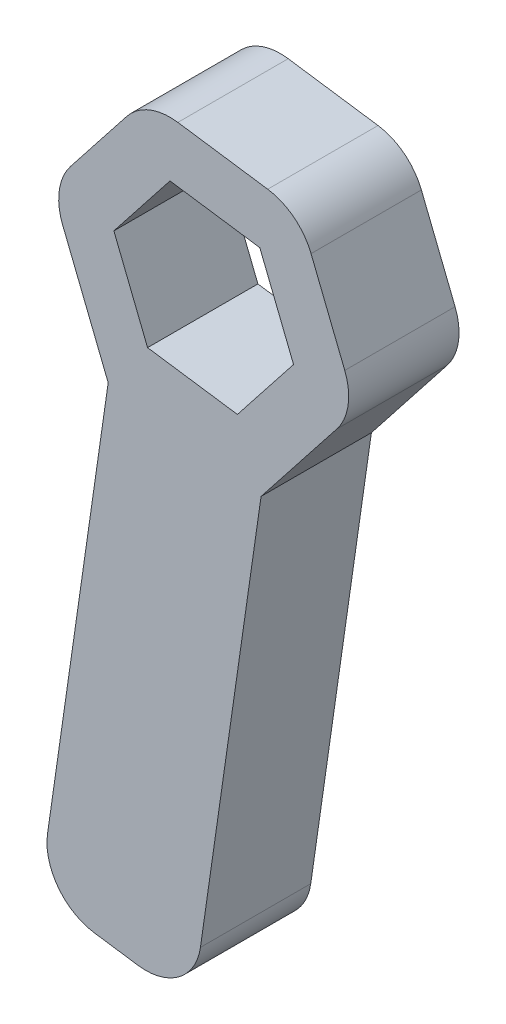
from build123d import *

# Parameters (mm, degrees)
BOSS_EXTRUDE1_DEPTH = 4


with BuildPart() as part:
    # Sketch1 → Boss-Extrude1 (new body)
    # profile 1 of 2: a face of its own
    with BuildSketch(Plane.XY):
        with BuildLine():
            ThreePointArc((-5.114216096, -0.273484418), (-5.236822192, 0.754506105), (-4.829006926, 1.70607506))
            Line((-4.829006926, 1.70607506), (-2.793952502, 4.29229885))
            ThreePointArc((-2.793952502, 4.29229885), (-1.964989642, 4.912474106), (-0.93699912, 5.035080203))
            Line((-0.93699912, 5.035080203), (2.320263594, 4.565783268))
            ThreePointArc((2.320263594, 4.565783268), (3.27183255, 4.157968002), (3.892007806, 3.329005142))
            Line((3.892007806, 3.329005142), (5.114216096, 0.273484418))
            ThreePointArc((5.114216096, 0.273484418), (5.236822192, -0.754506105), (4.829006926, -1.70607506))
            Line((4.829006926, -1.70607506), (2.079898318, -5.199745794))
            Line((2.079898318, -5.199745794), (-3.463162792, -4.401117677))
            Line((-3.463162792, -4.401117677), (-5.114216096, -0.273484418))
        make_face()
        Polygon((-2.035054424, -2.58622379), (1.22220829, -3.055520724), (3.257262714, -0.469296935), (2.035054424, 2.58622379), (-1.22220829, 3.055520724), (-3.257262714, 0.469296935), align=None, mode=Mode.SUBTRACT)
    # profile 2 of 2: a face of its own
    with BuildSketch(Plane.XY):
        with BuildLine():
            ThreePointArc((-3.967355061, -21.92537395), (-5.283579161, -21.143901064), (-5.66170537, -19.660605301))
            Line((-5.66170537, -19.660605301), (-3.463162792, -4.401117677))
            Line((-3.463162792, -4.401117677), (2.079898318, -5.199745794))
            Line((2.079898318, -5.199745794), (-0.11864426, -20.459233418))
            ThreePointArc((-0.11864426, -20.459233418), (-0.900117146, -21.775457517), (-2.383412909, -22.153583726))
            Line((-2.383412909, -22.153583726), (-3.967355061, -21.92537395))
        make_face()
    extrude(amount=BOSS_EXTRUDE1_DEPTH)


solid = part.part
